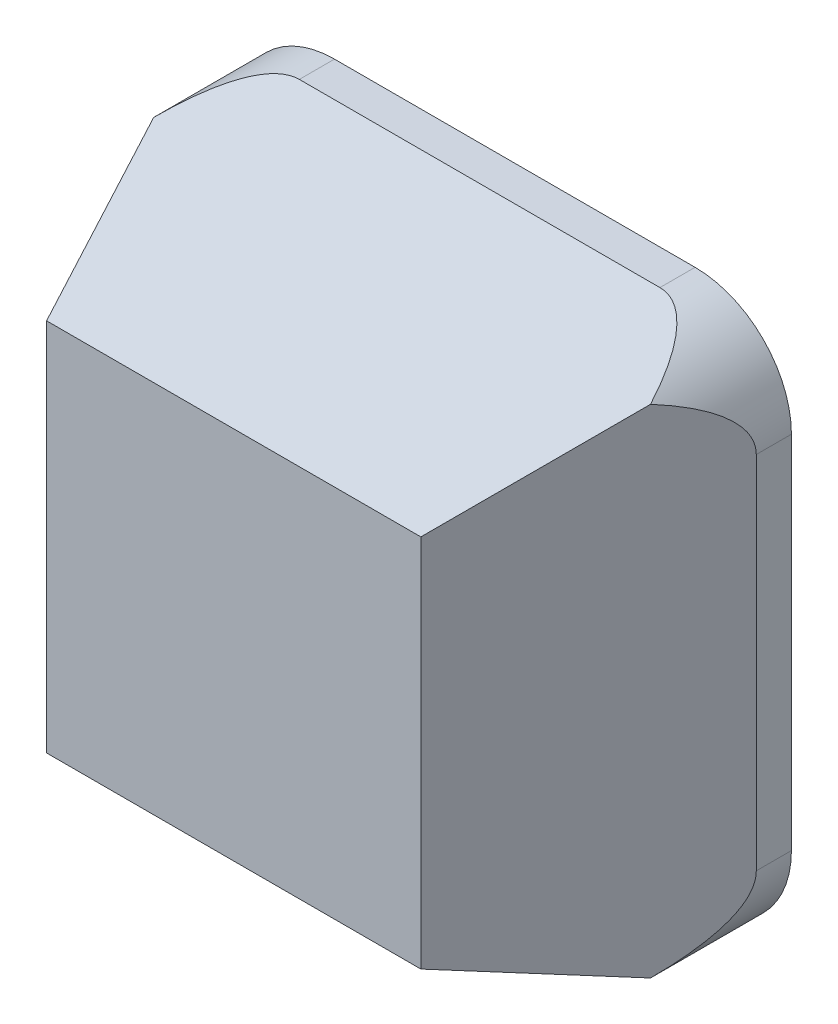
from build123d import *

# Parameters (mm, degrees)
SKETCH1_R           = 4.354315493
BOSS_EXTRUDE1_DEPTH = 12.7
CUT_EXTRUDE1_DEPTH  = 25.4
CUT_EXTRUDE2_DEPTH  = 25.4


with BuildPart() as part:
    # Sketch1 → Boss-Extrude1 (new body)
    with BuildSketch(Plane.XY):
        with BuildLine():
            ThreePointArc((-3.792038647, 8.146354139), (-8.146354139, 3.792038647), (-12.500669632, 8.146354139))
            Line((-12.500669632, 8.146354139), (-12.500669632, -8.146354139))
            ThreePointArc((-12.500669632, -8.146354139), (-8.146354139, -3.792038647), (-3.792038647, -8.146354139))
            ThreePointArc((-3.792038647, -8.146354139), (-5.067388127, -11.225320151), (-8.146354139, -12.500669632))
            Line((-8.146354139, -12.500669632), (8.146354139, -12.500669632))
            ThreePointArc((8.146354139, -12.500669632), (5.067388127, -5.067388127), (12.500669632, -8.146354139))
            Line((12.500669632, -8.146354139), (12.500669632, 8.146354139))
            ThreePointArc((12.500669632, 8.146354139), (5.067388127, 5.067388127), (8.146354139, 12.500669632))
            Line((8.146354139, 12.500669632), (-8.146354139, 12.500669632))
            ThreePointArc((-8.146354139, 12.500669632), (-5.067388127, 11.225320151), (-3.792038647, 8.146354139))
        make_face()
        with Locations((-8.146354139, 8.146354139)):
            Circle(SKETCH1_R)
        with Locations((-8.146354139, -8.146354139)):
            Circle(SKETCH1_R)
        with Locations((8.146354139, 8.146354139)):
            Circle(SKETCH1_R)
        with Locations((8.146354139, -8.146354139)):
            Circle(SKETCH1_R)
    extrude(amount=BOSS_EXTRUDE1_DEPTH)

    # Sketch2 → Cut-Extrude1 (cut, symmetric)
    with BuildSketch(Plane(origin=(0, 0, 0), x_dir=(0, 0, -1), z_dir=(1, 0, 0))):
        Polygon((-12.7, 12.500669632), (-1.5875, 12.500669632), (-12.7, 8.456050403), align=None)
        Polygon((-1.5875, -12.500669632), (-12.7, -8.456050403), (-12.7, -12.500669632), align=None)
    extrude(amount=CUT_EXTRUDE1_DEPTH, both=True, mode=Mode.SUBTRACT)

    # Sketch3 → Cut-Extrude2 (cut, symmetric)
    with BuildSketch(Plane(origin=(0, 0, 0), x_dir=(1, 0, 0), z_dir=(0, 1, 0))):
        Polygon((12.500669632, -1.5875), (8.456050403, -12.7), (12.500669632, -12.7), align=None)
        Polygon((-8.456050403, -12.7), (-12.500669632, -12.7), (-12.500669632, -1.5875), align=None)
    extrude(amount=CUT_EXTRUDE2_DEPTH, both=True, mode=Mode.SUBTRACT)


solid = part.part
